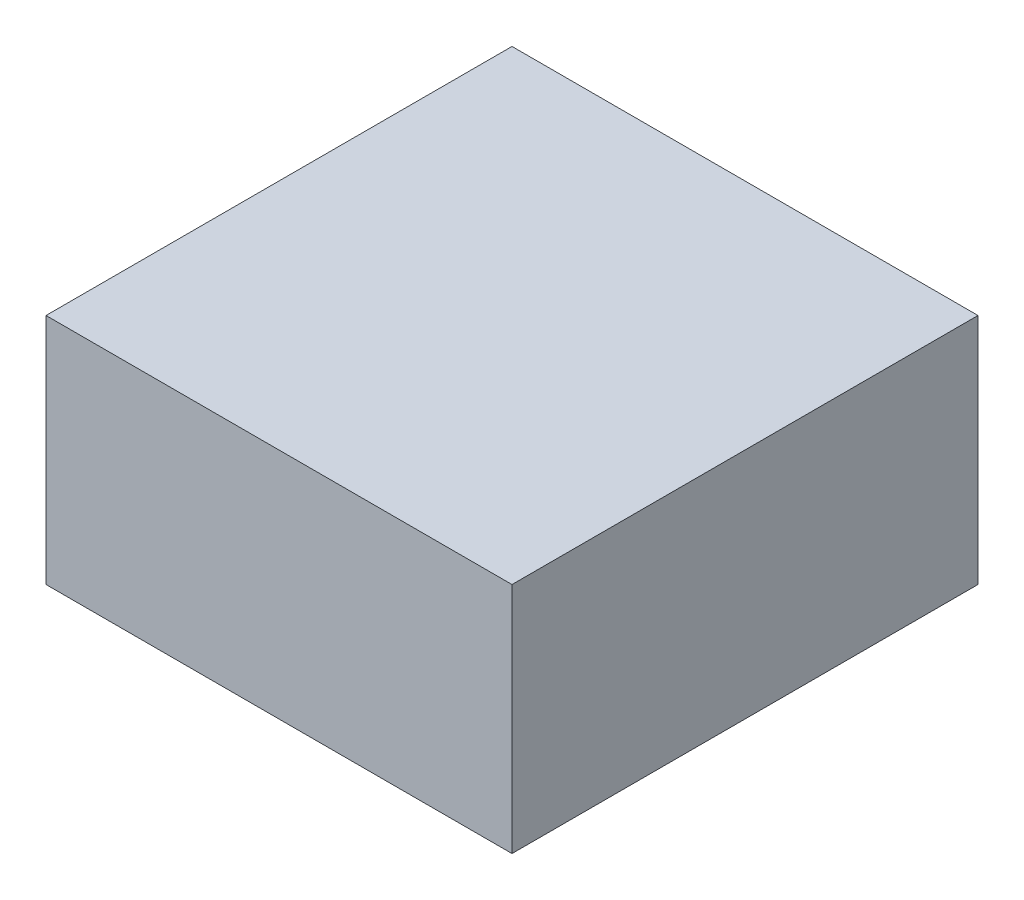
from build123d import *

# Parameters (mm, degrees)
SKETCH_1_W      = 10
SKETCH_1_H      = 5
EXTRUDE_1_DEPTH = 10


with BuildPart() as part:
    # 草图1 → 凸台-拉伸1 (new body)
    with BuildSketch(Plane.XY):
        with Locations((-23.578431373, 7.515586993)):
            Rectangle(SKETCH_1_W, SKETCH_1_H)
    extrude(amount=EXTRUDE_1_DEPTH)


solid = part.part
